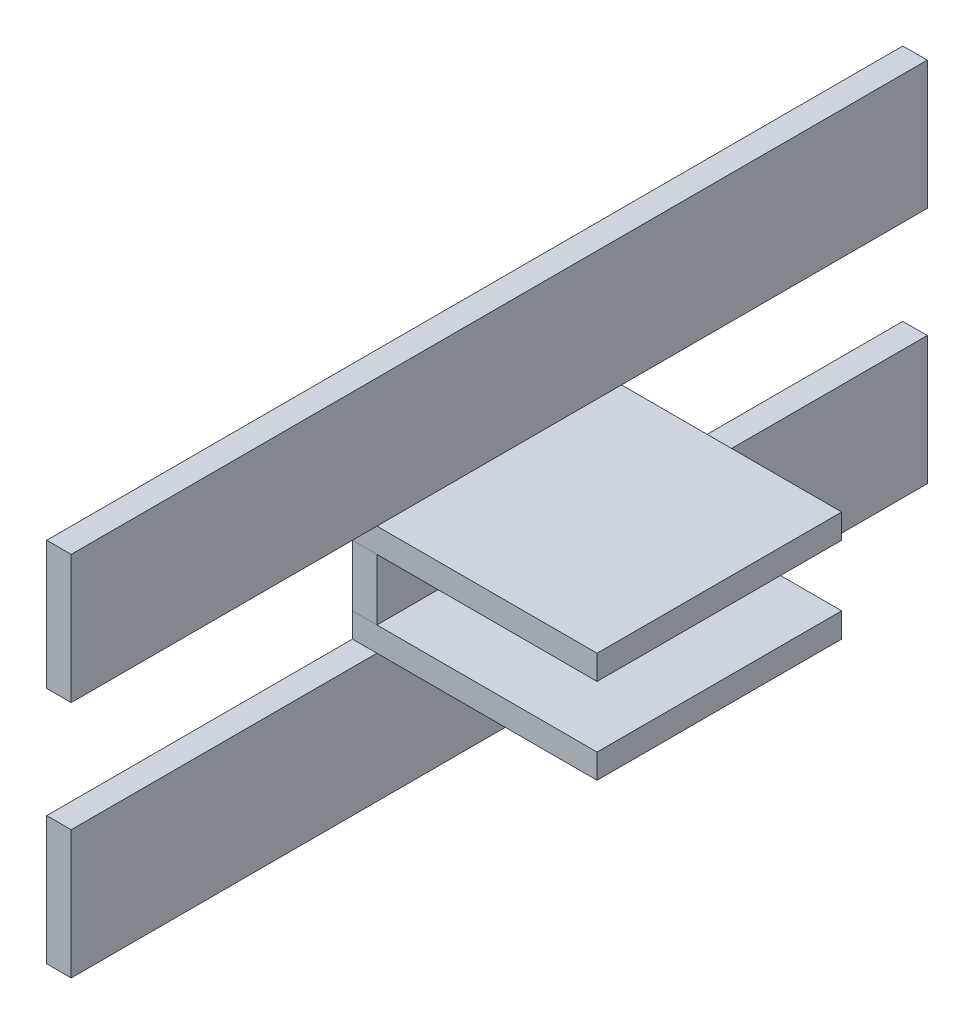
from build123d import *

# Parameters (mm, degrees)
SKETCH1_W             = 70
SKETCH1_H             = 10.5
BOSS_EXTRUDE1_DEPTH   = 2
SKETCH1_W_2           = 20
SKETCH1_H_2           = 5
BOSS_EXTRUDE1_2_DEPTH = 2
BOSS_EXTRUDE1_3_DEPTH = 2
SKETCH1_4_W           = 20
SKETCH1_4_H           = 2
BOSS_EXTRUDE2_DEPTH   = 20


with BuildPart() as part:
    # Sketch1 → Boss-Extrude1 (new body)
    with BuildSketch(Plane(origin=(0, 0, 0), x_dir=(0, 0, -1), z_dir=(1, 0, 0))):
        with Locations((35, 24.75)):
            Rectangle(SKETCH1_W, SKETCH1_H)
    extrude(amount=BOSS_EXTRUDE1_DEPTH)



with BuildPart() as body_2:
    # Sketch1 → Boss-Extrude1 2 (new body)
    with BuildSketch(Plane(origin=(0, 0, 0), x_dir=(0, 0, -1), z_dir=(1, 0, 0))):
        with Locations((35, 15)):
            Rectangle(SKETCH1_W_2, SKETCH1_H_2)
    extrude(amount=BOSS_EXTRUDE1_2_DEPTH)


with BuildPart() as body_3:
    # Sketch1 → Boss-Extrude1 3 (new body)
    with BuildSketch(Plane(origin=(0, 0, 0), x_dir=(0, 0, -1), z_dir=(1, 0, 0))):
        with Locations((35, 5.25)):
            Rectangle(SKETCH1_W, SKETCH1_H)
    extrude(amount=BOSS_EXTRUDE1_3_DEPTH)


with BuildPart() as part_1:
    add(part.part)

    add(body_3.part)  # Boss-Extrude2 merges body 3
    # Sketch1<4> → Boss-Extrude2 (add)
    with BuildSketch(Plane(origin=(0, 0, 0), x_dir=(0, 0, -1), z_dir=(1, 0, 0))):
        with Locations((35, 18.5)):
            Rectangle(SKETCH1_4_W, SKETCH1_4_H)
        with Locations((35, 11.5)):
            Rectangle(SKETCH1_4_W, SKETCH1_4_H)
    extrude(amount=BOSS_EXTRUDE2_DEPTH)


solid = Compound([body_2.part, part_1.part])
